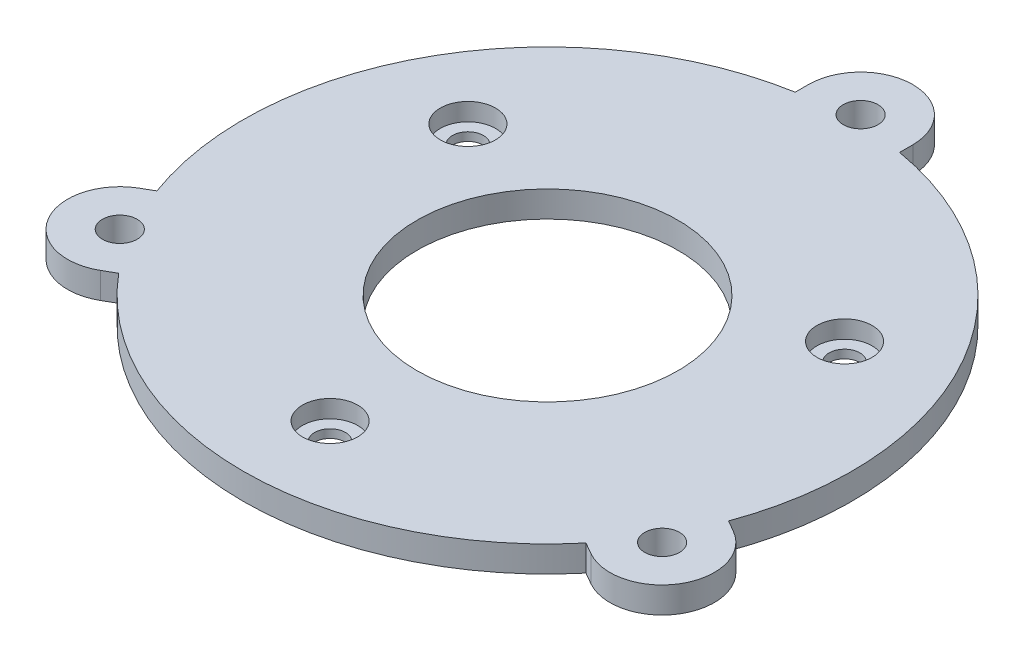
from build123d import *

# Parameters (mm, degrees)
BOSS_EXTRUDE1_DEPTH                            = 1.5
CBORE_FOR_0_SOCKET_HEAD_CAP_SCREW1_D           = 1.778
CBORE_FOR_0_SOCKET_HEAD_CAP_SCREW1_CBORE_D     = 3.175
CBORE_FOR_0_SOCKET_HEAD_CAP_SCREW1_CBORE_DEPTH = 1.016


with BuildPart() as part:
    # Sketch1 → Boss-Extrude1 (new body)
    with BuildSketch(Plane(origin=(0, 0, 0), x_dir=(1, 0, 0), z_dir=(0, 1, 0))):
        with BuildLine():
            ThreePointArc((-15.564231563, -8.000293485), (-16.028200148, -7.024727753), (-16.431091722, -6.022393613))
            Line((-16.431091722, -6.022393613), (-17.088457268, -6.401923789))
            ThreePointArc((-17.088457268, -6.401923789), (-18.186533479, -10.5), (-14.088457268, -11.598076211))
            Line((-14.088457268, -11.598076211), (-13.431091722, -11.218546036))
            ThreePointArc((-13.431091722, -11.218546036), (-14.097692763, -10.368464629), (-14.710573178, -9.478873181))
            ThreePointArc((-14.710573178, -9.478873181), (-16.454482672, -9.5), (-15.564231563, -8.000293485))
        make_face()
        with BuildLine():
            ThreePointArc((-7.45294045, -0.83885556), (-6.495190528, 3.75), (-3, 6.873863542))
            Line((-3, 6.873863542), (-3, 17.24093965))
            ThreePointArc((-3, 17.24093965), (-15.155444566, 8.75), (-16.431091722, -6.022393613))
            Line((-16.431091722, -6.022393613), (-7.45294045, -0.83885556))
        make_face()
        with BuildLine():
            ThreePointArc((-4.45294045, -6.035007983), (-6.495190528, -3.75), (-7.45294045, -0.83885556))
            Line((-7.45294045, -0.83885556), (-16.431091722, -6.022393613))
            ThreePointArc((-16.431091722, -6.022393613), (-16.028200148, -7.024727753), (-15.564231563, -8.000293485))
            ThreePointArc((-15.564231563, -8.000293485), (-14.872836662, -8.301510811), (-14.588457268, -9))
            ThreePointArc((-14.588457268, -9), (-14.619467049, -9.247099079), (-14.710573178, -9.478873181))
            ThreePointArc((-14.710573178, -9.478873181), (-14.097692763, -10.368464629), (-13.431091722, -11.218546036))
            Line((-13.431091722, -11.218546036), (-4.45294045, -6.035007983))
        make_face()
        with BuildLine():
            ThreePointArc((4.45294045, -6.035007983), (0, -7.5), (-4.45294045, -6.035007983))
            Line((-4.45294045, -6.035007983), (-13.431091722, -11.218546036))
            ThreePointArc((-13.431091722, -11.218546036), (0, -17.5), (13.431091722, -11.218546036))
            Line((13.431091722, -11.218546036), (4.45294045, -6.035007983))
        make_face()
        with BuildLine():
            ThreePointArc((7.45294045, -0.83885556), (6.495190528, -3.75), (4.45294045, -6.035007983))
            Line((4.45294045, -6.035007983), (13.431091722, -11.218546036))
            ThreePointArc((13.431091722, -11.218546036), (14.097692763, -10.368464629), (14.710573178, -9.478873181))
            ThreePointArc((14.710573178, -9.478873181), (14.722431864, -8.5), (15.564231563, -8.000293485))
            ThreePointArc((15.564231563, -8.000293485), (16.028200148, -7.024727753), (16.431091722, -6.022393613))
            Line((16.431091722, -6.022393613), (7.45294045, -0.83885556))
        make_face()
        with BuildLine():
            Line((3, 17.24093965), (3, 6.873863542))
            ThreePointArc((3, 6.873863542), (6.274950199, 4.107919181), (7.5, 0))
            ThreePointArc((7.5, 0), (7.48822587, -0.420087268), (7.45294045, -0.83885556))
            Line((7.45294045, -0.83885556), (16.431091722, -6.022393613))
            ThreePointArc((16.431091722, -6.022393613), (17.230700873, -3.05825889), (17.5, 0))
            ThreePointArc((17.5, 0), (13.393095236, 11.263880326), (3, 17.24093965))
        make_face()
        with BuildLine():
            Line((-3, 18), (-3, 17.24093965))
            ThreePointArc((-3, 17.24093965), (-1.930507386, 17.393192382), (-0.853658385, 17.479166667))
            ThreePointArc((-0.853658385, 17.479166667), (-0.27050103, 18.962719685), (1, 18))
            ThreePointArc((1, 18), (0.962719685, 17.72949897), (0.853658385, 17.479166667))
            ThreePointArc((0.853658385, 17.479166667), (1.930507386, 17.393192382), (3, 17.24093965))
            Line((3, 17.24093965), (3, 18))
            ThreePointArc((3, 18), (0, 21), (-3, 18))
        make_face()
        with BuildLine():
            Line((-3, 17.24093965), (-3, 6.873863542))
            ThreePointArc((-3, 6.873863542), (0, 7.5), (3, 6.873863542))
            Line((3, 6.873863542), (3, 17.24093965))
            ThreePointArc((3, 17.24093965), (1.930507386, 17.393192382), (0.853658385, 17.479166667))
            ThreePointArc((0.853658385, 17.479166667), (0, 17), (-0.853658385, 17.479166667))
            ThreePointArc((-0.853658385, 17.479166667), (-1.930507386, 17.393192382), (-3, 17.24093965))
        make_face()
        with BuildLine():
            ThreePointArc((14.710573178, -9.478873181), (14.097692763, -10.368464629), (13.431091722, -11.218546036))
            Line((13.431091722, -11.218546036), (14.088457268, -11.598076211))
            ThreePointArc((14.088457268, -11.598076211), (18.186533479, -10.5), (17.088457268, -6.401923789))
            Line((17.088457268, -6.401923789), (16.431091722, -6.022393613))
            ThreePointArc((16.431091722, -6.022393613), (16.028200148, -7.024727753), (15.564231563, -8.000293485))
            ThreePointArc((15.564231563, -8.000293485), (16.286946457, -8.284379393), (16.588457268, -9))
            ThreePointArc((16.588457268, -9), (15.835556347, -9.968990219), (14.710573178, -9.478873181))
        make_face()
    extrude(amount=BOSS_EXTRUDE1_DEPTH)

    # CBORE for #0 Socket Head Cap Screw1 (through all)
    with Locations(Plane(origin=(0, 1.5, 0), x_dir=(1, 0, 0), z_dir=(0, 1, 0))):
        with Locations((-10.825317547, 6.25), (10.825317547, 6.25), (0, -12.5)):
            CounterBoreHole(CBORE_FOR_0_SOCKET_HEAD_CAP_SCREW1_D / 2, CBORE_FOR_0_SOCKET_HEAD_CAP_SCREW1_CBORE_D / 2, CBORE_FOR_0_SOCKET_HEAD_CAP_SCREW1_CBORE_DEPTH)


solid = part.part
